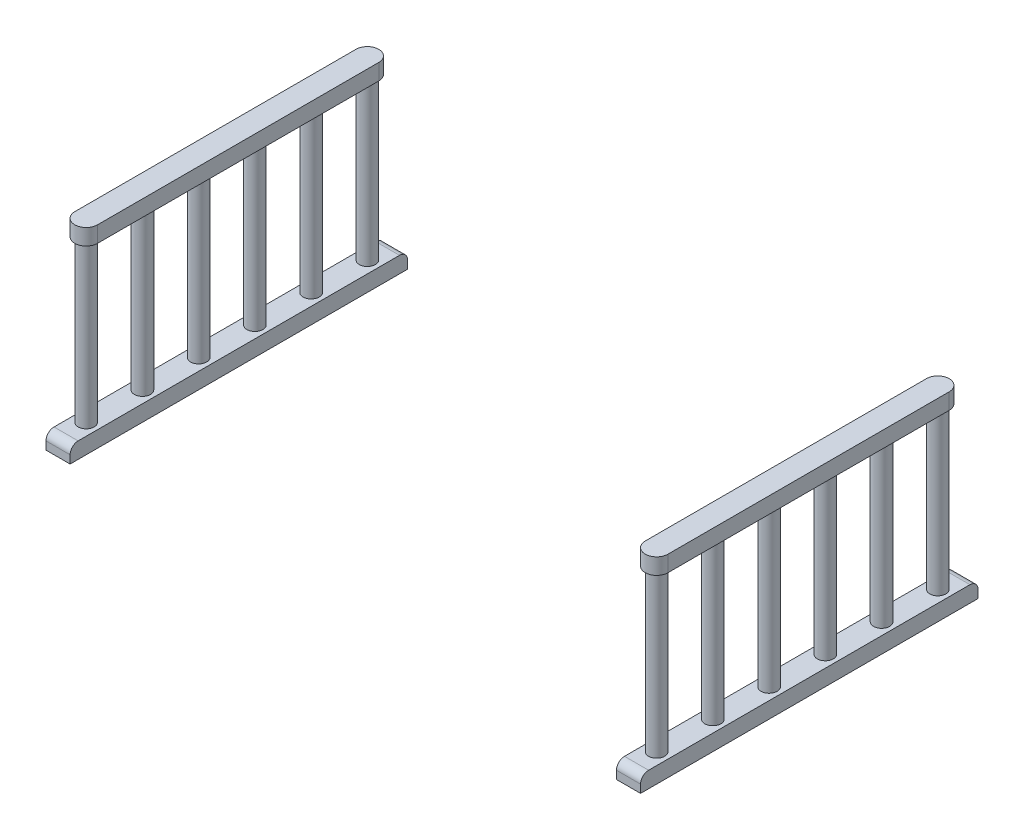
from build123d import *

# Parameters (mm, degrees)
SKETCH2_W             = 150
SKETCH2_H             = 2100
BOSS_EXTRUDE3_DEPTH   = 100
BOSS_EXTRUDE3_2_DEPTH = 100
SKETCH3_R             = 50
BOSS_EXTRUDE4_DEPTH   = 1000
LPATTERN1_COUNT       = 6
LPATTERN1_PITCH       = 350
SKETCH5_R             = 50
BOSS_EXTRUDE5_DEPTH   = 1000
LPATTERN2_COUNT       = 6
LPATTERN2_PITCH       = 350
FILLET1_R             = 50
FILLET2_R             = 50
FILLET3_R             = 50
FILLET4_R             = 50
BOSS_EXTRUDE8_DEPTH   = 100


with BuildPart() as part:
    # Sketch2 → Boss-Extrude3 (new body)
    with BuildSketch(Plane(origin=(0, 0, 0), x_dir=(1, 0, 0), z_dir=(0, 1, 0))):
        with Locations((1775, 1037.975951904)):
            Rectangle(SKETCH2_W, SKETCH2_H)
    extrude(amount=BOSS_EXTRUDE3_DEPTH)

    # Sketch5 → Boss-Extrude5 (add)
    with BuildSketch(Plane(origin=(0, 100, 0), x_dir=(1, 0, 0), z_dir=(0, 1, 0))):
        with Locations(Location((1775, 1912.975951904, 0), (0, 0, 270))):
            Circle(SKETCH5_R)
    boss_extrude5 = extrude(amount=BOSS_EXTRUDE5_DEPTH)

    # LPattern2: Boss-Extrude5 ×6
    with Locations(*[(0, 0, i * LPATTERN2_PITCH) for i in range(1, LPATTERN2_COUNT)]):
        add(boss_extrude5)

    # Fillet3
    fillet3_edges = [part.edges().sort_by_distance(p)[0] for p in [
        (1775, 100, 12.024048096),
    ]]
    fillet(fillet3_edges, radius=FILLET3_R)

    # Fillet4
    fillet4_edges = [part.edges().sort_by_distance(p)[0] for p in [
        (1775, 100, -2087.975951904),
    ]]
    fillet(fillet4_edges, radius=FILLET4_R)



with BuildPart() as body_2:
    # Sketch2 → Boss-Extrude3 2 (new body)
    with BuildSketch(Plane(origin=(0, 0, 0), x_dir=(1, 0, 0), z_dir=(0, 1, 0))):
        with Locations((-1775, 1037.975951904)):
            Rectangle(SKETCH2_W, SKETCH2_H)
    extrude(amount=BOSS_EXTRUDE3_2_DEPTH)

    # Sketch3 → Boss-Extrude4 (add)
    with BuildSketch(Plane(origin=(0, 100, 0), x_dir=(1, 0, 0), z_dir=(0, 1, 0))):
        with Locations(Location((-1775, 162.975951904, 0), (0, 0, 90))):
            Circle(SKETCH3_R)
    boss_extrude4 = extrude(amount=BOSS_EXTRUDE4_DEPTH)

    # LPattern1: Boss-Extrude4 ×6
    with Locations(*[(0, 0, -i * LPATTERN1_PITCH) for i in range(1, LPATTERN1_COUNT)]):
        add(boss_extrude4)

    # Fillet1
    fillet1_edges = [body_2.edges().sort_by_distance(p)[0] for p in [
        (-1775, 100, -2087.975951904),
    ]]
    fillet(fillet1_edges, radius=FILLET1_R)

    # Fillet2
    fillet2_edges = [body_2.edges().sort_by_distance(p)[0] for p in [
        (-1775, 100, 12.024048096),
    ]]
    fillet(fillet2_edges, radius=FILLET2_R)


with BuildPart() as part_1:
    add(part.part)

    add(body_2.part)  # Boss-Extrude8 merges body 2
    # Sketch13 → Boss-Extrude8 (add)
    with BuildSketch(Plane(origin=(0, 1100, 0), x_dir=(1, 0, 0), z_dir=(0, 1, 0))):
        with BuildLine():
            Line((-1845.838339321, 162.975951904), (-1845.838339321, 1912.975951904))
            ThreePointArc((-1845.838339321, 1912.975951904), (-1775, 1983.814291225), (-1704.161660679, 1912.975951904))
            Line((-1704.161660679, 1912.975951904), (-1704.161660679, 162.975951904))
            ThreePointArc((-1704.161660679, 162.975951904), (-1775, 92.137612583), (-1845.838339321, 162.975951904))
        make_face()
        with BuildLine():
            Line((1845.838339321, 162.975951904), (1845.838339321, 1912.975951904))
            ThreePointArc((1845.838339321, 1912.975951904), (1775, 1983.814291225), (1704.161660679, 1912.975951904))
            Line((1704.161660679, 1912.975951904), (1704.161660679, 162.975951904))
            ThreePointArc((1704.161660679, 162.975951904), (1775, 92.137612583), (1845.838339321, 162.975951904))
        make_face()
    extrude(amount=BOSS_EXTRUDE8_DEPTH)


solid = part_1.part
